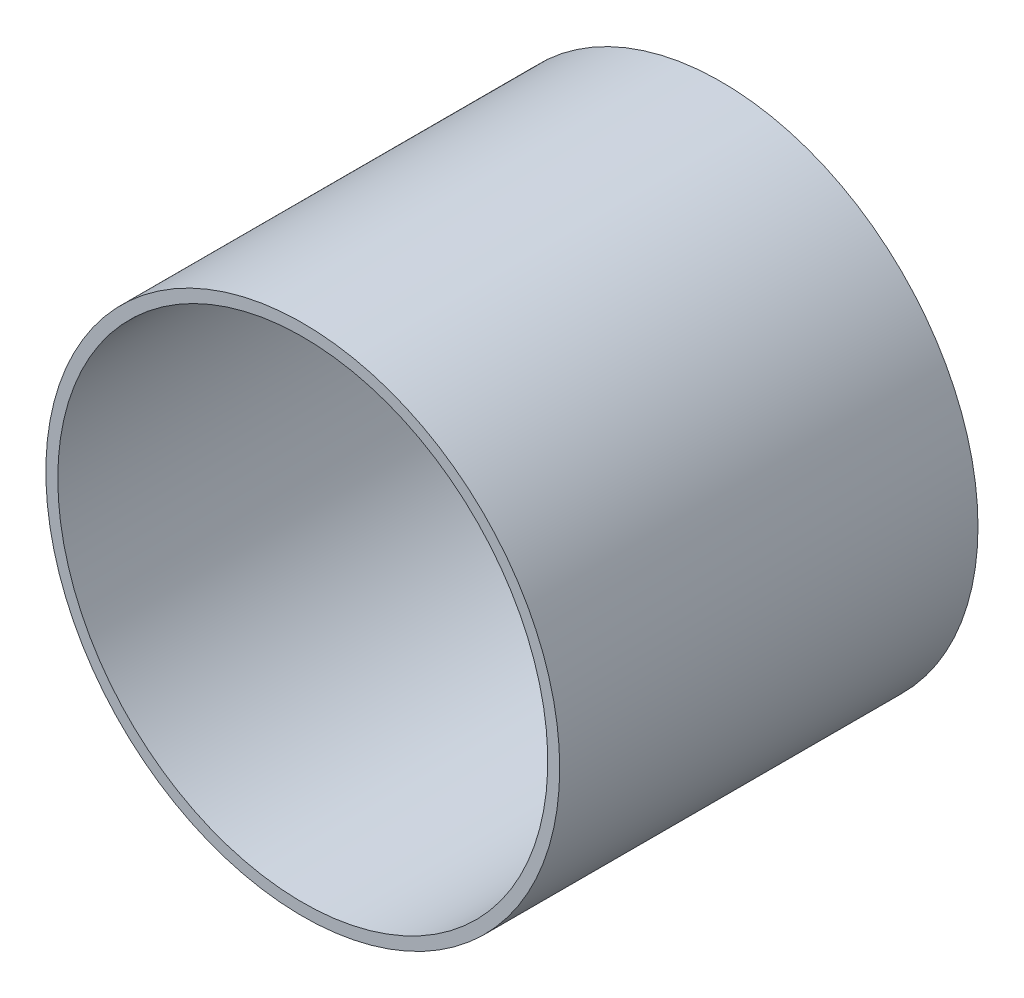
from build123d import *

# Parameters (mm, degrees)
SKETCH3_R           = 215
BOSS_EXTRUDE2_DEPTH = 350
SKETCH4_R           = 205
CUT_EXTRUDE1_DEPTH  = 350


with BuildPart() as part:
    # Sketch3 → Boss-Extrude2 (new body)
    with BuildSketch(Plane.XY):
        Circle(SKETCH3_R)
    extrude(amount=BOSS_EXTRUDE2_DEPTH)

    # Sketch4 → Cut-Extrude1 (cut)
    with BuildSketch(Plane(origin=(0, 0, 0), x_dir=(-1, 0, 0), z_dir=(0, 0, -1))):
        Circle(SKETCH4_R)
    extrude(amount=-CUT_EXTRUDE1_DEPTH, mode=Mode.SUBTRACT)


solid = part.part
